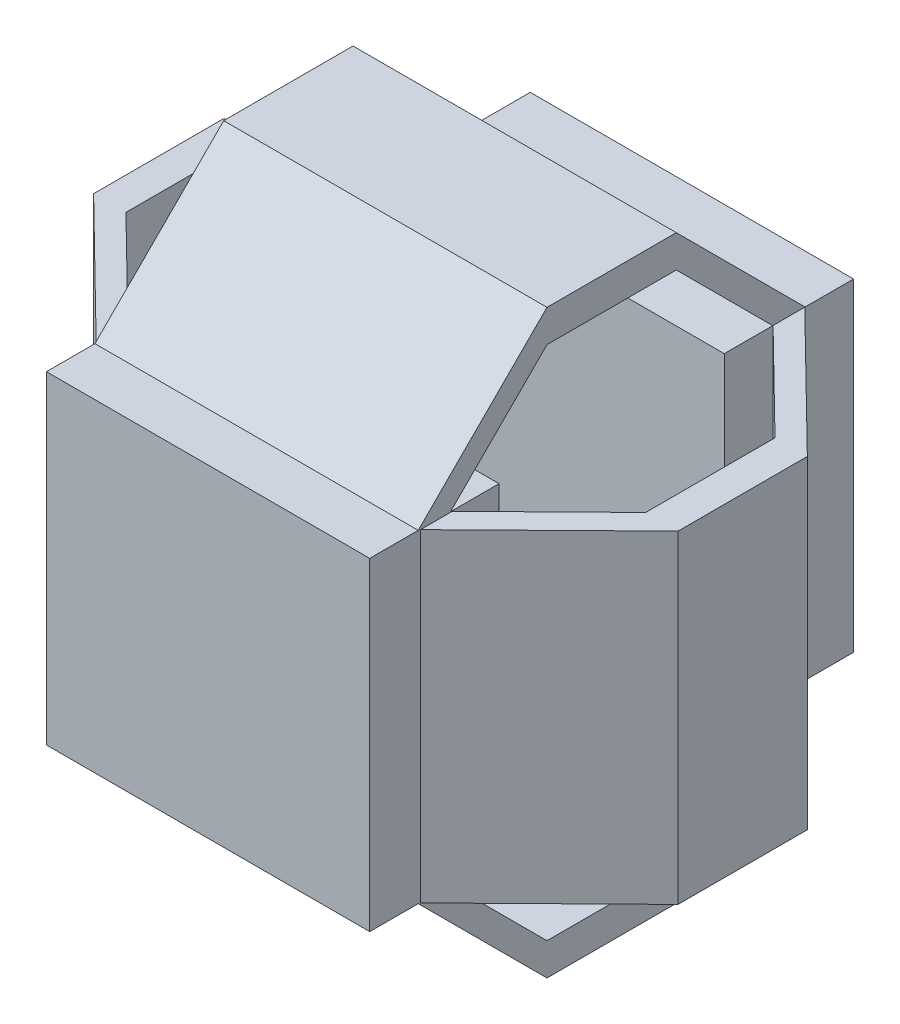
from build123d import *

# Parameters (mm, degrees)
SKETCH2_W                = 5
SKETCH2_H                = 5
BOSS_EXTRUDE1_DEPTH      = 2
BOSS_EXTRUDE3_DEPTH      = 5
BOSS_EXTRUDE4_DEPTH      = 5
SKETCH12_W               = 5
SKETCH12_H               = 0.5
BOSS_EXTRUDE5_DEPTH      = 1
SKETCH13_W               = 0.5
SKETCH13_H               = 5
BOSS_EXTRUDE6_DEPTH      = 1
MIRROR8_COPY_1_SKETCH_W  = 5
MIRROR8_COPY_1_SKETCH_H  = 0.5
MIRROR8_COPY_1_DEPTH     = 1
MIRROR9_COPY_1_DEPTH     = 5
MIRROR14_COPY_1_SKETCH_W = 0.5
MIRROR14_COPY_1_SKETCH_H = 5
MIRROR14_COPY_1_DEPTH    = 1
BOSS_EXTRUDE7_DEPTH      = 5


with BuildPart() as part:
    # Sketch2 → Boss-Extrude1 (new body)
    with BuildSketch(Plane.XY):
        Rectangle(SKETCH2_W, SKETCH2_H)
    boss_extrude1 = extrude(amount=BOSS_EXTRUDE1_DEPTH)

    # Sketch4 → Boss-Extrude3 (add)
    with BuildSketch(Plane(origin=(2.5, 0, 0), x_dir=(0, 0, -1), z_dir=(1, 0, 0))):
        Polygon((-1.25, -2.5), (-2.741508092, -3.991508092), (-2.741508092, -4.491508092), (-0.75, -2.5), align=None)
    boss_extrude3 = extrude(amount=-BOSS_EXTRUDE3_DEPTH)

    # Sketch9 → Boss-Extrude4 (add)
    with BuildSketch(Plane(origin=(0, 2.5, 0), x_dir=(1, 0, 0), z_dir=(0, 1, 0))):
        Polygon((2.5, -0.754950985), (4.519335319, -2.734295506), (4.019335319, -2.734295506), (2.5, -1.245049015), align=None)
    boss_extrude4 = extrude(amount=-BOSS_EXTRUDE4_DEPTH)

    # Mirror2: Boss-Extrude3 across plane
    add(boss_extrude3.mirror(Plane.ZX))

    # Mirror3: Boss-Extrude4 across plane
    add(boss_extrude4.mirror(Plane(origin=(0, 0, 0), x_dir=(0, 0, 1), z_dir=(1, 0, 0))))

    # Sketch12 → Boss-Extrude5 (add)
    with BuildSketch(Plane.XY.offset(2.741508092)):
        with Locations((0, -4.241508092)):
            Rectangle(SKETCH12_W, SKETCH12_H)
    boss_extrude5 = extrude(amount=BOSS_EXTRUDE5_DEPTH)

    # Sketch13 → Boss-Extrude6 (add)
    with BuildSketch(Plane.XY.offset(2.734295506)):
        with Locations((4.269335319, 0)):
            Rectangle(SKETCH13_W, SKETCH13_H)
    boss_extrude6 = extrude(amount=BOSS_EXTRUDE6_DEPTH)

    # Mirror4: Boss-Extrude5 across plane
    add(boss_extrude5.mirror(Plane.ZX))

    # Mirror5: Boss-Extrude6 across plane
    add(boss_extrude6.mirror(Plane(origin=(0, 0, 0), x_dir=(0, 0, 1), z_dir=(1, 0, 0))))

    # Mirror8: Boss-Extrude5 across plane
    add(boss_extrude5.mirror(Plane.XY.offset(3.741508092)))

    # Mirror8 copy 1 sketch → Mirror8 copy 1 (add)
    with BuildSketch(Plane(origin=(0, 0, 4.741508092), x_dir=(1, 0, 0), z_dir=(0, 0, -1))):
        with Locations((0, -4.241508092)):
            Rectangle(MIRROR8_COPY_1_SKETCH_W, MIRROR8_COPY_1_SKETCH_H)
    extrude(amount=MIRROR8_COPY_1_DEPTH)

    # Mirror9: Boss-Extrude3 across plane
    add(boss_extrude3.mirror(Plane.XY.offset(3.741508092)))

    # Mirror9 copy 1 sketch → Mirror9 copy 1 (add)
    with BuildSketch(Plane(origin=(2.5, 0, 7.483016184), x_dir=(0, 0, 1), z_dir=(1, 0, 0))):
        Polygon((-1.25, -2.5), (-2.741508092, -3.991508092), (-2.741508092, -4.491508092), (-0.75, -2.5), align=None)
    extrude(amount=-MIRROR9_COPY_1_DEPTH)

    # Mirror14: Boss-Extrude6 across plane
    add(boss_extrude6.mirror(Plane.XY.offset(3.734295506)))

    # Mirror14 copy 1 sketch → Mirror14 copy 1 (add)
    with BuildSketch(Plane(origin=(0, 0, 4.734295506), x_dir=(-1, 0, 0), z_dir=(0, 0, -1))):
        with Locations((4.269335319, 0)):
            Rectangle(MIRROR14_COPY_1_SKETCH_W, MIRROR14_COPY_1_SKETCH_H)
    extrude(amount=MIRROR14_COPY_1_DEPTH)

    # Sketch14 → Boss-Extrude7 (add)
    with BuildSketch(Plane.XZ.offset(2.5)):
        Polygon((4.519335319, 4.734295506), (4.019335319, 4.734295506), (2.508072629, 6.215629239), (2.508072629, 6.705727268), align=None)
    boss_extrude7 = extrude(amount=-BOSS_EXTRUDE7_DEPTH)

    # Mirror15: Boss-Extrude7 across plane
    add(boss_extrude7.mirror(Plane(origin=(0, 0, 0), x_dir=(0, 0, 1), z_dir=(1, 0, 0))))

    # Mirror16: Boss-Extrude1 across plane
    add(boss_extrude1.mirror(Plane.XY.offset(3.741508092)))


solid = part.part
